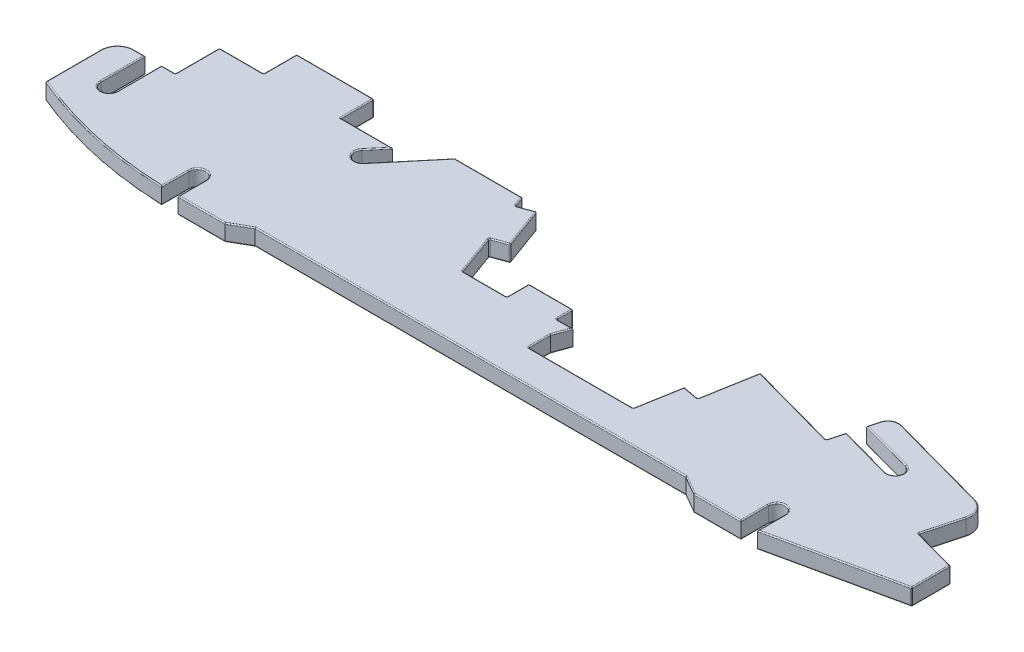
from build123d import *

# Parameters (mm, degrees)
BOSS_EXTRUDE1_DEPTH = 3
FILLET1_R           = 0.2


with BuildPart() as part:
    # Sketch1 → Boss-Extrude1 (new body)
    with BuildSketch(Plane(origin=(0, 0, 0), x_dir=(1, 0, 0), z_dir=(0, 1, 0))):
        with BuildLine():
            Line((-1.5, 0), (-1.5, -5))
            Line((-1.5, -5), (-10, -5))
            Line((-10, -5), (-13.464101615, -3))
            Line((-13.464101615, -3), (-91.535898385, -3))
            Line((-91.535898385, -3), (-95, -5))
            Line((-95, -5), (-103.5, -5))
            Line((-103.5, -5), (-103.5, 0))
            ThreePointArc((-103.5, 0), (-105, 1.5), (-106.5, 0))
            Line((-106.5, 0), (-106.5, -5))
            ThreePointArc((-106.5, -5), (-120.278978154, -3.255401694), (-133.5, 1))
            Line((-133.5, 1), (-133.5, 11))
            ThreePointArc((-133.5, 11), (-132.621320344, 13.121320344), (-130.5, 14))
            Line((-130.5, 14), (-128.5, 14))
            Line((-128.5, 14), (-128.5, 6))
            ThreePointArc((-128.5, 6), (-127, 4.5), (-125.5, 6))
            Line((-125.5, 6), (-125.5, 14))
            Line((-125.5, 14), (-123, 14))
            Line((-123, 14), (-123, 22))
            Line((-123, 22), (-115, 22))
            Line((-115, 22), (-115, 28))
            Line((-115, 28), (-101, 28))
            Line((-101, 28), (-101, 22))
            Line((-101, 22), (-91.601712409, 22))
            Line((-91.601712409, 22), (-94.149066665, 18.964181415))
            ThreePointArc((-94.149066665, 18.964181415), (-93.964181415, 16.850933335), (-91.850933335, 17.035818585))
            Line((-91.850933335, 17.035818585), (-84.329092017, 26))
            Line((-84.329092017, 26), (-72.09558328, 26))
            Line((-72.09558328, 26), (-71.38041159, 24.035081933))
            Line((-71.38041159, 24.035081933), (-68.561333728, 25.061142363))
            Line((-68.561333728, 25.061142363), (-65.825172581, 17.543601396))
            Line((-65.825172581, 17.543601396), (-68.644250444, 16.517540966))
            Line((-68.644250444, 16.517540966), (-65.908089297, 9))
            Line((-65.908089297, 9), (-57.908089297, 9))
            Line((-57.908089297, 9), (-57.908089297, 13))
            Line((-57.908089297, 13), (-49.908089297, 13))
            Line((-49.908089297, 13), (-49.908089297, 10))
            Line((-49.908089297, 10), (-46.908089297, 10))
            Line((-46.908089297, 10), (-48, 7))
            Line((-48, 7), (-48, 3))
            Line((-48, 3), (-29, 3))
            Line((-29, 3), (-27.610814579, 10.878462024))
            Line((-27.610814579, 10.878462024), (-24.65639132, 10.357517491))
            Line((-24.65639132, 10.357517491), (-22.956161492, 20))
            Line((-22.956161492, 20), (-6.560221994, 15.508545007))
            Line((-6.560221994, 15.508545007), (-5.767612289, 18.401946095))
            Line((-5.767612289, 18.401946095), (3.877058004, 15.759913746))
            ThreePointArc((3.877058004, 15.759913746), (5.720063401, 16.810309438), (4.669667709, 18.653314834))
            Line((4.669667709, 18.653314834), (-4.975002584, 21.295347183))
            Line((-4.975002584, 21.295347183), (-4.446596115, 23.224281242))
            ThreePointArc((-4.446596115, 23.224281242), (-3.507984611, 24.433476923), (-1.989255586, 24.624808831))
            Line((-1.989255586, 24.624808831), (16.335617971, 19.604947368))
            ThreePointArc((16.335617971, 19.604947368), (18.149411494, 18.197030113), (18.436409355, 15.918936575))
            Line((18.436409355, 15.918936575), (16.586986711, 9.16766737))
            Line((16.586986711, 9.16766737), (24.5, 7))
            Line((24.5, 7), (24.5, 0))
            Line((24.5, 0), (1.5, -5))
            Line((1.5, -5), (1.5, 0))
            ThreePointArc((1.5, 0), (0, 1.5), (-1.5, 0))
        make_face()
    extrude(amount=BOSS_EXTRUDE1_DEPTH)

    # Fillet1
    fillet1_edges = [part.edges().sort_by_distance(p)[0] for p in [
        (13, 3, 2.5),
        (-88.090012676, 3, -21.517909293),
        (-93.964181415, 3, -16.850933335),
        (-92.875389537, 3, -20.482090707),
        (-96.300856205, 3, -22),
        (-101, 3, -25),
        (-108, 3, -28),
        (-115, 3, -25),
        (-119, 3, -22),
        (-123, 3, -18),
        (-124.25, 3, -14),
        (24.5, 3, -3.5),
        (-125.5, 3, -10),
        (-127, 3, -4.5),
        (-128.5, 3, -10),
        (-129.5, 3, -14),
        (-132.621320344, 3, -13.121320344),
        (-133.5, 3, -6),
        (-120.278978154, 3, 3.255401694),
        (-106.5, 3, 2.5),
        (-105, 3, -1.5),
        (-103.5, 3, 2.5),
        (20.543493355, 3, -8.083833685),
        (-99.25, 3, 5),
        (-93.267949192, 3, 4),
        (-52.5, 3, 3),
        (-11.732050808, 3, 4),
        (-5.75, 3, 5),
        (-1.5, 3, 2.5),
        (17.511698033, 3, -12.543301972),
        (18.149411494, 3, -18.197030113),
        (7.173181193, 3, -22.114878099),
        (-3.507984611, 3, -24.433476923),
        (-4.710799349, 3, -22.259814212),
        (-0.152667438, 3, -19.974331009),
        (5.720063401, 3, -16.810309438),
        (0, 3, -1.5),
        (-0.945277142, 3, -17.080929921),
        (-6.163917141, 3, -16.955245551),
        (-14.758191743, 3, -17.754272503),
        (-1.5, 0, 2.5),
        (-5.75, 0, 5),
        (-11.732050808, 0, 4),
        (-52.5, 0, 3),
        (-23.806276406, 3, -15.178758746),
        (-93.267949192, 0, 4),
        (-99.25, 0, 5),
        (-103.5, 0, 2.5),
        (-105, 0, -1.5),
        (-106.5, 0, 2.5),
        (-120.278978154, 0, 3.255401694),
        (-133.5, 0, -6),
        (-26.133602949, 3, -10.617989758),
        (-132.621320344, 0, -13.121320344),
        (-129.5, 0, -14),
        (-128.5, 0, -10),
        (-127, 0, -4.5),
        (-125.5, 0, -10),
        (-124.25, 0, -14),
        (-123, 0, -18),
        (-119, 0, -22),
        (-28.305407289, 3, -6.939231012),
        (-115, 0, -25),
        (-108, 0, -28),
        (-101, 0, -25),
        (-96.300856205, 0, -22),
        (-92.875389537, 0, -20.482090707),
        (-93.964181415, 0, -16.850933335),
        (-88.090012676, 0, -21.517909293),
        (-38.5, 3, -3),
        (-78.212337648, 0, -26),
        (-71.737997435, 0, -25.017540966),
        (-69.970872659, 0, -24.548112148),
        (-67.193253155, 0, -21.302371879),
        (-67.234711513, 0, -17.030571181),
        (-67.276169871, 0, -12.758770483),
        (-61.908089297, 0, -9),
        (-57.908089297, 0, -11),
        (-48, 3, -5),
        (-53.908089297, 0, -13),
        (-49.908089297, 0, -11.5),
        (-48.408089297, 0, -10),
        (-47.454044649, 0, -8.5),
        (-48, 0, -5),
        (-38.5, 0, -3),
        (-28.305407289, 0, -6.939231012),
        (-47.454044649, 3, -8.5),
        (-26.133602949, 0, -10.617989758),
        (-23.806276406, 0, -15.178758746),
        (-14.758191743, 0, -17.754272503),
        (-6.163917141, 0, -16.955245551),
        (-0.945277142, 0, -17.080929921),
        (5.720063401, 0, -16.810309438),
        (-0.152667438, 0, -19.974331009),
        (-4.710799349, 0, -22.259814212),
        (-48.408089297, 3, -10),
        (-3.507984611, 0, -24.433476923),
        (7.173181193, 0, -22.114878099),
        (18.149411494, 0, -18.197030113),
        (17.511698033, 0, -12.543301972),
        (20.543493355, 0, -8.083833685),
        (24.5, 0, -3.5),
        (13, 0, 2.5),
        (1.5, 3, 2.5),
        (-49.908089297, 3, -11.5),
        (1.5, 0, 2.5),
        (0, 0, -1.5),
        (-53.908089297, 3, -13),
        (-57.908089297, 3, -11),
        (-61.908089297, 3, -9),
        (-67.276169871, 3, -12.758770483),
        (-67.234711513, 3, -17.030571181),
        (-67.193253155, 3, -21.302371879),
        (-133.5, 1.5, -1),
        (-123, 1.5, -14),
        (-123, 1.5, -22),
        (-115, 1.5, -22),
        (-115, 1.5, -28),
        (-101, 1.5, -28),
        (-69.970872659, 3, -24.548112148),
        (-72.09558328, 1.5, -26),
        (-71.38041159, 1.5, -24.035081933),
        (-68.561333728, 1.5, -25.061142363),
        (-65.825172581, 1.5, -17.543601396),
        (-68.644250444, 1.5, -16.517540966),
        (-65.908089297, 1.5, -9),
        (-57.908089297, 1.5, -9),
        (-57.908089297, 1.5, -13),
        (-49.908089297, 1.5, -13),
        (-49.908089297, 1.5, -10),
        (-48, 1.5, -3),
        (-29, 1.5, -3),
        (-27.610814579, 1.5, -10.878462024),
        (-24.65639132, 1.5, -10.357517491),
        (-22.956161492, 1.5, -20),
        (-6.560221994, 1.5, -15.508545007),
        (16.586986711, 1.5, -9.16766737),
        (24.5, 1.5, -7),
        (24.5, 1.5, 0),
        (-71.737997435, 3, -25.017540966),
        (-78.212337648, 3, -26),
    ]]
    fillet(fillet1_edges, radius=FILLET1_R)


solid = part.part
